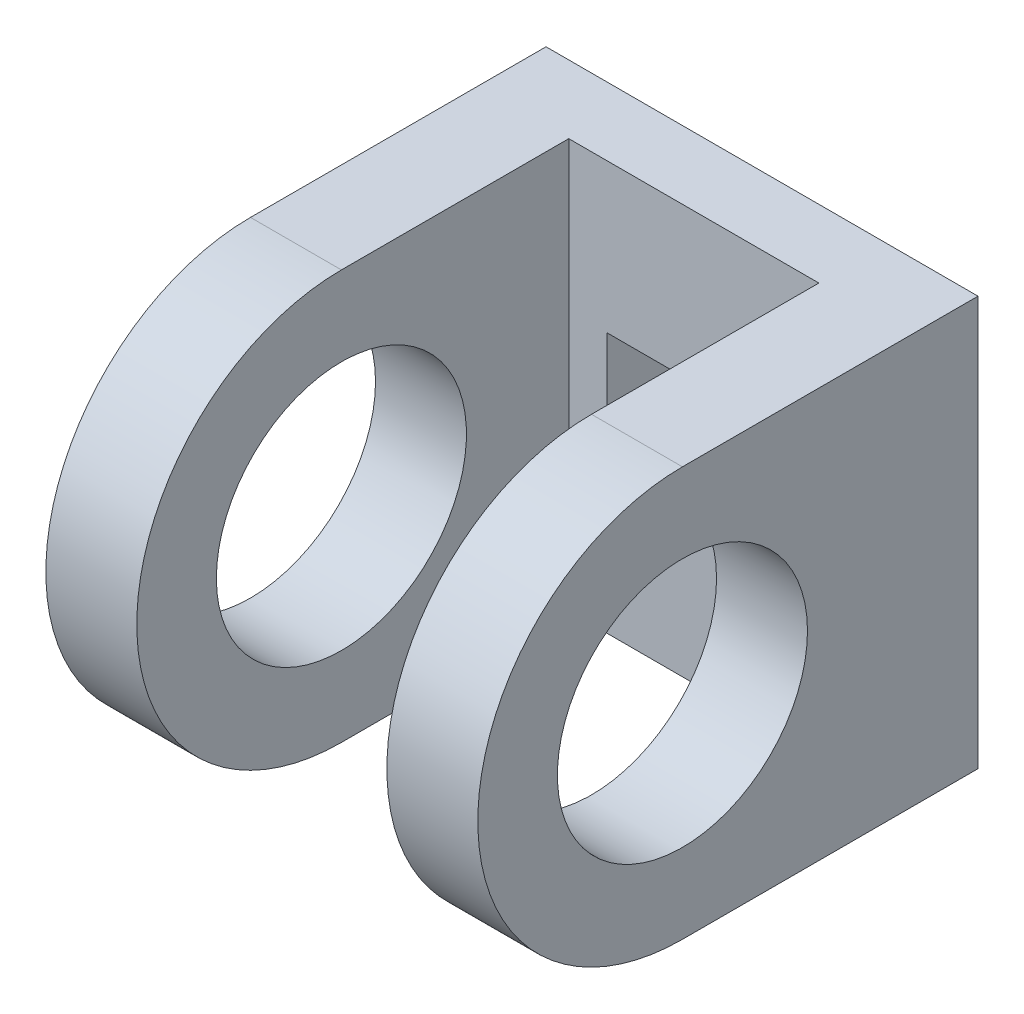
from build123d import *

# Parameters (mm, degrees)
SKETCH1_R           = 5.499999036
BOSS_EXTRUDE1_DEPTH = 19
SKETCH2_W           = 11
SKETCH2_H           = 19
CUT_EXTRUDE1_DEPTH  = 33
SKETCH3_W           = 7.598245287
SKETCH3_H           = 4.916511656
CUT_EXTRUDE2_DEPTH  = 33


with BuildPart() as part:
    # Sketch1 → Boss-Extrude1 (new body)
    with BuildSketch(Plane(origin=(0, 0, 0), x_dir=(0, 0, -1), z_dir=(1, 0, 0))):
        with BuildLine():
            Line((-1.999999523, 9.000000954), (11.000000477, 9.000000954))
            Line((11.000000477, 9.000000954), (11.000000477, -9.000000954))
            Line((11.000000477, -9.000000954), (-1.999999523, -9.000000954))
            ThreePointArc((-1.999999523, -9.000000954), (-11.000000477, 0), (-1.999999523, 9.000000954))
        make_face()
        with Locations((-1.999999523, 0)):
            Circle(SKETCH1_R, mode=Mode.SUBTRACT)
    extrude(amount=BOSS_EXTRUDE1_DEPTH)

    # Sketch2 → Cut-Extrude1 (cut)
    with BuildSketch(Plane(origin=(0, 9.000000954, 0), x_dir=(1, 0, 0), z_dir=(0, 1, 0))):
        with Locations((9.5, -1.500000477)):
            Rectangle(SKETCH2_W, SKETCH2_H)
    extrude(amount=-CUT_EXTRUDE1_DEPTH, mode=Mode.SUBTRACT)

    # Sketch3 → Cut-Extrude2 (cut)
    with BuildSketch(Plane.XY.offset(-7.999999523)):
        with Locations((9.476309149, -0.011845426)):
            Rectangle(SKETCH3_W, SKETCH3_H)
    extrude(amount=-CUT_EXTRUDE2_DEPTH, mode=Mode.SUBTRACT)


solid = part.part
